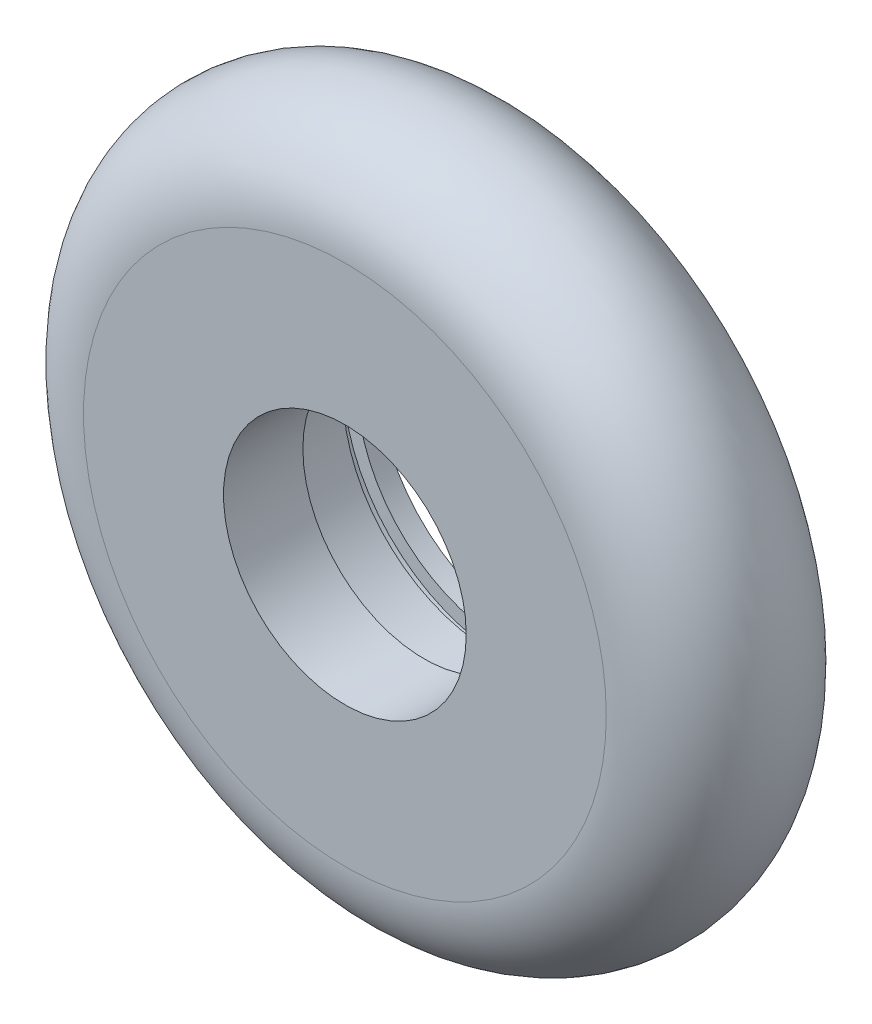
from build123d import *

# Parameters (mm, degrees)
SKETCH_2_R          = 16
CUT_EXTRUDE_1_DEPTH = 11
SKETCH_3_W          = 1.5
SKETCH_3_H          = 1.5


with BuildPart() as part:
    # 草图1 → 旋转1 (revolve)
    with BuildSketch(Plane(origin=(0, 0, 0), x_dir=(1, 0, 0), z_dir=(0, 1, 0))):
        with BuildLine():
            Line((13, 0), (28, 0))
            ThreePointArc((28, 0), (37.75, 9.75), (28, 19.5))
            Line((28, 19.5), (13, 19.5))
            Line((13, 19.5), (13, 0))
        make_face()
    revolve(axis=Axis((0, 0, 0), (0, 0, -1)))

    # 草图2 → 切除-拉伸1 (cut)
    with BuildSketch(Plane(origin=(0, 0, -19.5), x_dir=(-1, 0, 0), z_dir=(0, 0, -1))):
        Circle(SKETCH_2_R)
    extrude(amount=-CUT_EXTRUDE_1_DEPTH, mode=Mode.SUBTRACT)

    # 草图3 → 切除-旋转1 (revolve, cut)
    with BuildSketch(Plane(origin=(0, 0, 0), x_dir=(1, 0, 0), z_dir=(0, 1, 0)), mode=Mode.PRIVATE) as cut_revolve_1_sk:
        with Locations((16.75, 16.55)):
            Rectangle(SKETCH_3_W, SKETCH_3_H)
    revolve(cut_revolve_1_sk.sketch.rotate(Axis((0, 0, 0), (0, 0, -1)), 180), axis=Axis((0, 0, 0), (0, 0, -1)), mode=Mode.SUBTRACT)


solid = part.part
